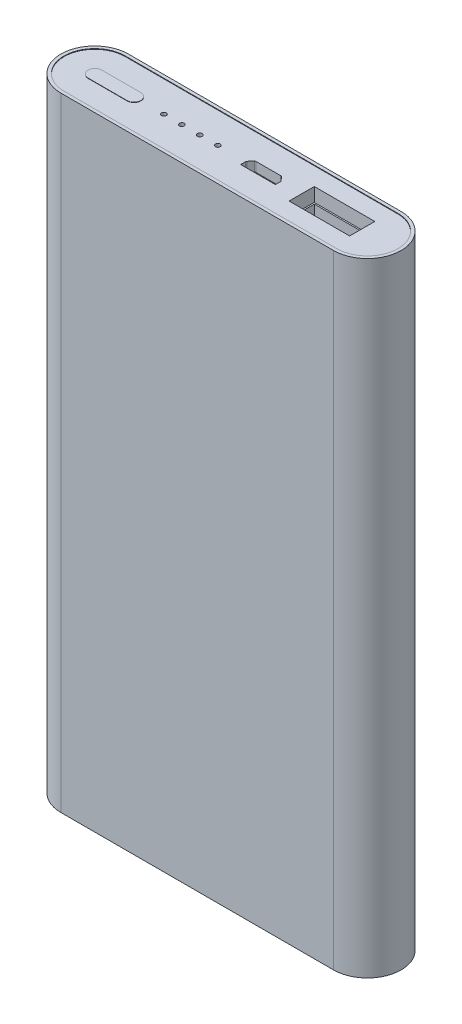
from build123d import *

# Parameters (mm, degrees)
BOSS_EXTRUDE1_DEPTH = 65
BOSS_EXTRUDE2_DEPTH = 129.75
SKETCH5_W           = 1.39
SKETCH5_H           = 3.378
CUT_EXTRUDE1_DEPTH  = 0.25
SKETCH8_R           = 0.5
CUT_EXTRUDE2_DEPTH  = 2
BOSS_EXTRUDE3_DEPTH = 0.0625
SKETCH11_W          = 12.625
SKETCH11_H          = 5.25
CUT_EXTRUDE4_DEPTH  = 11.75
SKETCH12_W          = 12.625
SKETCH12_H          = 5.25
SKETCH12_W_2        = 12.025
SKETCH12_H_2        = 4.65
BOSS_EXTRUDE4_DEPTH = 8.875
SKETCH13_W          = 11.525
SKETCH13_H          = 1.56
BOSS_EXTRUDE5_DEPTH = 8.875
CUT_EXTRUDE5_DEPTH  = 10
SKETCH17_W          = 5.5
SKETCH17_H          = 0.125
BOSS_EXTRUDE6_DEPTH = 8.1
BOSS_EXTRUDE7_START = 8
BOSS_EXTRUDE7_DEPTH = 8


with BuildPart() as part:
    # Sketch1 → Boss-Extrude1 (new, symmetric)
    with BuildSketch(Plane(origin=(0, 0, 0), x_dir=(1, 0, 0), z_dir=(0, 1, 0))):
        with BuildLine():
            Line((-28.45, 7.05), (28.45, 7.05))
            ThreePointArc((28.45, 7.05), (35.5, 0), (28.45, -7.05))
            Line((28.45, -7.05), (-28.45, -7.05))
            ThreePointArc((-28.45, -7.05), (-35.5, 0), (-28.45, 7.05))
        make_face()
        with BuildLine():
            Line((-28.45, 6.38), (28.45, 6.38))
            ThreePointArc((28.45, 6.38), (34.83, 0), (28.45, -6.38))
            Line((28.45, -6.38), (-28.45, -6.38))
            ThreePointArc((-28.45, -6.38), (-34.83, 0), (-28.45, 6.38))
        make_face(mode=Mode.SUBTRACT)
    extrude(amount=BOSS_EXTRUDE1_DEPTH, both=True)

    # Sketch2 → Boss-Extrude2 (add)
    with BuildSketch(Plane(origin=(0, 64.875, 0), x_dir=(1, 0, 0), z_dir=(0, 1, 0))):
        with BuildLine():
            Line((-28.45, -6.38), (28.45, -6.38))
            ThreePointArc((28.45, -6.38), (34.83, 0), (28.45, 6.38))
            Line((28.45, 6.38), (-28.45, 6.38))
            ThreePointArc((-28.45, 6.38), (-34.83, 0), (-28.45, -6.38))
        make_face()
    extrude(amount=-BOSS_EXTRUDE2_DEPTH)

    # Sketch5 → Cut-Extrude1 (cut)
    with BuildSketch(Plane(origin=(0, 0, -7.05), x_dir=(-1, 0, 0), z_dir=(0, 0, -1))):
        Polygon((3.047959184, -38.5), (4.369798182, -38.5), (4.369798182, -33), (3.039285714, -33), align=None)
        with BuildLine():
            Line((-4.125, -33), (-4.125, -38.5))
            Line((-4.125, -38.5), (-2.775, -38.5))
            Line((-2.775, -38.5), (-2.775, -34.15))
            Line((-2.775, -34.15), (-0.025, -34.15))
            ThreePointArc((-0.025, -34.15), (0.481245093, -34.446327571), (0.675, -35))
            Line((0.675, -35), (0.675, -38.5))
            Line((0.675, -38.5), (1.975, -38.5))
            Line((1.975, -38.5), (1.975, -34.330645161))
            add(Edge.make_bspline(
                [(1.975, -34.330645161), (1.946635107, -34.301634388), (1.95702187, -34.248224197), (1.948979592, -34.215322581), (1.924253679, -34.114166856), (1.916519719, -34.042472973), (1.870918367, -33.949193548), (1.843725239, -33.893568896), (1.820050271, -33.836269814), (1.792857143, -33.780645161), (1.758600377, -33.710571549), (1.699108422, -33.633824398), (1.645408163, -33.576612903), (1.280199443, -33.187524707), (1.016815103, -33.047701351), (0.457142857, -33)],
                knots=[0, 0, 0, 0, 1, 1, 1, 2, 2, 2, 3, 3, 3, 4, 4, 4, 5, 5, 5, 5], degree=3))
            Line((0.457142857, -33), (-4.125, -33))
        make_face()
        with Locations((-1.06, -36.811)):
            Rectangle(SKETCH5_W, SKETCH5_H)
    extrude(amount=-CUT_EXTRUDE1_DEPTH, mode=Mode.SUBTRACT)

    # Sketch8 → Cut-Extrude2 (cut)
    with BuildSketch(Plane(origin=(0, 64.875, 0), x_dir=(1, 0, 0), z_dir=(0, 1, 0))):
        with Locations(Location((-14, 0, 0), (0, 0, 270))):
            Circle(SKETCH8_R)
        with Locations(Location((-10.25, 0, 0), (0, 0, 270))):
            Circle(SKETCH8_R)
        with Locations(Location((-6.5, 0, 0), (0, 0, 270))):
            Circle(SKETCH8_R)
        with Locations(Location((-2.75, 0, 0), (0, 0, 270))):
            Circle(SKETCH8_R)
    extrude(amount=-CUT_EXTRUDE2_DEPTH, mode=Mode.SUBTRACT)

    # Sketch9 → Boss-Extrude3 (add)
    with BuildSketch(Plane(origin=(0, 64.875, 0), x_dir=(1, 0, 0), z_dir=(0, 1, 0))):
        with BuildLine():
            Line((-28.375, 1.4375), (-20.25, 1.4375))
            ThreePointArc((-20.25, 1.4375), (-18.8125, 0), (-20.25, -1.4375))
            Line((-20.25, -1.4375), (-28.375, -1.4375))
            ThreePointArc((-28.375, -1.4375), (-29.8125, 0), (-28.375, 1.4375))
        make_face()
    extrude(amount=BOSS_EXTRUDE3_DEPTH)

    # Sketch11 → Cut-Extrude4 (cut)
    with BuildSketch(Plane(origin=(0, 64.875, 0), x_dir=(1, 0, 0), z_dir=(0, 1, 0))):
        with Locations((21.0625, 0)):
            Rectangle(SKETCH11_W, SKETCH11_H)
    extrude(amount=-CUT_EXTRUDE4_DEPTH, mode=Mode.SUBTRACT)

    # Sketch12 → Boss-Extrude4 (add)
    with BuildSketch(Plane(origin=(0, 53.125, 0), x_dir=(1, 0, 0), z_dir=(0, 1, 0))):
        with Locations((21.0625, 0)):
            Rectangle(SKETCH12_W, SKETCH12_H)
        with Locations((21.0625, 0)):
            Rectangle(SKETCH12_W_2, SKETCH12_H_2, mode=Mode.SUBTRACT)
    extrude(amount=BOSS_EXTRUDE4_DEPTH)

    # Sketch13 → Boss-Extrude5 (add)
    with BuildSketch(Plane(origin=(0, 53.125, 0), x_dir=(1, 0, 0), z_dir=(0, 1, 0))):
        with Locations((21.0625, -1.17)):
            Rectangle(SKETCH13_W, SKETCH13_H)
    extrude(amount=BOSS_EXTRUDE5_DEPTH)

    # Sketch16 → Cut-Extrude5 (cut)
    with BuildSketch(Plane(origin=(0, 64.875, 0), x_dir=(1, 0, 0), z_dir=(0, 1, 0))):
        with BuildLine():
            Line((4.111130468, 1.08), (9.338869532, 1.08))
            ThreePointArc((9.338869532, 1.08), (9.462834417, 1.053189874), (9.56464254, 0.977551382))
            Line((9.56464254, 0.977551382), (10.275773008, 0.164830848))
            ThreePointArc((10.275773008, 0.164830848), (10.330830823, 0.072797467), (10.35, -0.032720535))
            Line((10.35, -0.032720535), (10.35, -1.08))
            Line((10.35, -1.08), (3.1, -1.08))
            Line((3.1, -1.08), (3.1, -0.032720535))
            ThreePointArc((3.1, -0.032720535), (3.119169177, 0.072797467), (3.174226992, 0.164830848))
            Line((3.174226992, 0.164830848), (3.88535746, 0.977551382))
            ThreePointArc((3.88535746, 0.977551382), (3.987165583, 1.053189874), (4.111130468, 1.08))
        make_face()
    extrude(amount=-CUT_EXTRUDE5_DEPTH, mode=Mode.SUBTRACT)

    # Sketch17 → Boss-Extrude6 (add)
    with BuildSketch(Plane(origin=(0, 54.875, 0), x_dir=(1, 0, 0), z_dir=(0, 1, 0))):
        with Locations((6.725, -0.7675)):
            Rectangle(SKETCH17_W, SKETCH17_H)
    extrude(amount=BOSS_EXTRUDE6_DEPTH)

    # Sketch18 → Boss-Extrude7 (add)
    with BuildSketch(Plane(origin=(0, 54.875, 0), x_dir=(1, 0, 0), z_dir=(0, 1, 0)).offset(BOSS_EXTRUDE7_START)):
        with BuildLine():
            Line((3.1, -1.08), (10.35, -1.08))
            Line((10.35, -1.08), (10.35, -0.032720535))
            ThreePointArc((10.35, -0.032720535), (10.330830823, 0.072797467), (10.275773008, 0.164830848))
            Line((10.275773008, 0.164830848), (9.56464254, 0.977551382))
            ThreePointArc((9.56464254, 0.977551382), (9.462834417, 1.053189874), (9.338869532, 1.08))
            Line((9.338869532, 1.08), (4.111130468, 1.08))
            ThreePointArc((4.111130468, 1.08), (3.987165583, 1.053189874), (3.88535746, 0.977551382))
            Line((3.88535746, 0.977551382), (3.174226992, 0.164830848))
            ThreePointArc((3.174226992, 0.164830848), (3.119169177, 0.072797467), (3.1, -0.032720535))
            Line((3.1, -0.032720535), (3.1, -1.08))
        make_face()
        with BuildLine():
            Line((3.225, -0.032720535), (3.225, -0.955))
            Line((3.225, -0.955), (10.225, -0.955))
            Line((10.225, -0.955), (10.225, -0.032720535))
            ThreePointArc((10.225, -0.032720535), (10.21381798, 0.028831633), (10.181700922, 0.082517772))
            Line((10.181700922, 0.082517772), (9.470570454, 0.895238306))
            ThreePointArc((9.470570454, 0.895238306), (9.411182381, 0.93936076), (9.338869532, 0.955))
            Line((9.338869532, 0.955), (4.111130468, 0.955))
            ThreePointArc((4.111130468, 0.955), (4.038817619, 0.93936076), (3.979429546, 0.895238306))
            Line((3.979429546, 0.895238306), (3.268299078, 0.082517772))
            ThreePointArc((3.268299078, 0.082517772), (3.23618202, 0.028831633), (3.225, -0.032720535))
        make_face(mode=Mode.SUBTRACT)
    extrude(amount=-BOSS_EXTRUDE7_DEPTH)


solid = part.part
